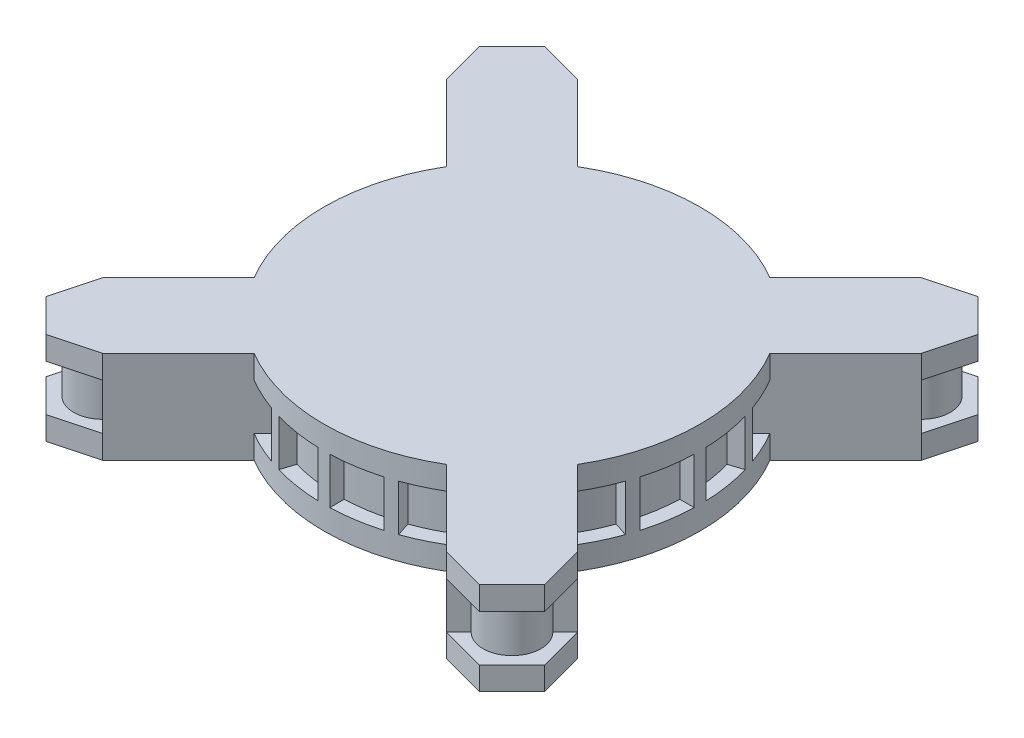
from build123d import *

# Parameters (mm, degrees)
BOSS_EXTRUDE8_DEPTH  = 4
BOSS_EXTRUDE10_DEPTH = 8
BOSS_EXTRUDE11_DEPTH = 4


with BuildPart() as part:
    # Sketch11 → Boss-Extrude8 (new body)
    with BuildSketch(Plane(origin=(0, 0, 0), x_dir=(1, 0, 0), z_dir=(0, 1, 0))):
        with BuildLine():
            Line((27.930717857, -16.617009358), (41.012193309, -29.69848481))
            Line((41.012193309, -29.69848481), (43.08274567, -37.42589142))
            Line((43.08274567, -37.42589142), (37.42589142, -43.08274567))
            Line((37.42589142, -43.08274567), (29.69848481, -41.012193309))
            Line((29.69848481, -41.012193309), (16.617009358, -27.930717857))
            ThreePointArc((16.617009358, -27.930717857), (0, -32.5), (-16.617009358, -27.930717857))
            Line((-16.617009358, -27.930717857), (-29.69848481, -41.012193309))
            Line((-29.69848481, -41.012193309), (-37.42589142, -43.08274567))
            Line((-37.42589142, -43.08274567), (-43.08274567, -37.42589142))
            Line((-43.08274567, -37.42589142), (-41.012193309, -29.69848481))
            Line((-41.012193309, -29.69848481), (-27.930717857, -16.617009358))
            ThreePointArc((-27.930717857, -16.617009358), (-32.5, 0), (-27.930717857, 16.617009358))
            Line((-27.930717857, 16.617009358), (-41.012193309, 29.69848481))
            Line((-41.012193309, 29.69848481), (-43.08274567, 37.42589142))
            Line((-43.08274567, 37.42589142), (-37.42589142, 43.08274567))
            Line((-37.42589142, 43.08274567), (-29.69848481, 41.012193309))
            Line((-29.69848481, 41.012193309), (-16.617009358, 27.930717857))
            ThreePointArc((-16.617009358, 27.930717857), (0, 32.5), (16.617009358, 27.930717857))
            Line((16.617009358, 27.930717857), (29.69848481, 41.012193309))
            Line((29.69848481, 41.012193309), (37.42589142, 43.08274567))
            Line((37.42589142, 43.08274567), (43.08274567, 37.42589142))
            Line((43.08274567, 37.42589142), (41.012193309, 29.69848481))
            Line((41.012193309, 29.69848481), (27.930717857, 16.617009358))
            ThreePointArc((27.930717857, 16.617009358), (32.5, 0), (27.930717857, -16.617009358))
        make_face()
    extrude(amount=BOSS_EXTRUDE8_DEPTH)

    # Sketch12 → Boss-Extrude10 (add)
    with BuildSketch(Plane(origin=(0, 4, 0), x_dir=(1, 0, 0), z_dir=(0, 1, 0))):
        with BuildLine():
            Line((38.890872967, 31.819805152), (41.012193309, 29.69848481))
            Line((41.012193309, 29.69848481), (26.10190255, 14.788194051))
            ThreePointArc((26.10190255, 14.788194051), (27.250407583, 12.546524879), (28.206823147, 10.216414633))
            Line((28.206823147, 10.216414633), (30.585684682, 10.9893536))
            ThreePointArc((30.585684682, 10.9893536), (30.90933678, 10.043052317), (31.203718671, 9.087240568))
            Line((31.203718671, 9.087240568), (28.824857136, 8.3143016))
            ThreePointArc((28.824857136, 8.3143016), (29.630650218, 4.693033951), (29.983328701, 1))
            Line((29.983328701, 1), (32.484611742, 1))
            ThreePointArc((32.484611742, 1), (32.5, 0), (32.484611742, -1))
            Line((32.484611742, -1), (29.983328701, -1))
            ThreePointArc((29.983328701, -1), (29.630650218, -4.693033951), (28.824857136, -8.3143016))
            Line((28.824857136, -8.3143016), (31.203718671, -9.087240568))
            ThreePointArc((31.203718671, -9.087240568), (30.90933678, -10.043052317), (30.585684682, -10.9893536))
            Line((30.585684682, -10.9893536), (28.206823147, -10.216414633))
            ThreePointArc((28.206823147, -10.216414633), (27.250407583, -12.546524879), (26.10190255, -14.788194051))
            Line((26.10190255, -14.788194051), (41.012193309, -29.69848481))
            Line((41.012193309, -29.69848481), (38.890872965, -31.819805153))
            ThreePointArc((38.890872965, -31.819805153), (38.890872965, -38.890872967), (31.819805152, -38.890872967))
            Line((31.819805152, -38.890872967), (29.69848481, -41.012193309))
            Line((29.69848481, -41.012193309), (14.788194051, -26.10190255))
            ThreePointArc((14.788194051, -26.10190255), (12.546524879, -27.250407583), (10.216414633, -28.206823147))
            Line((10.216414633, -28.206823147), (10.9893536, -30.585684682))
            ThreePointArc((10.9893536, -30.585684682), (10.043052317, -30.90933678), (9.087240568, -31.203718671))
            Line((9.087240568, -31.203718671), (8.3143016, -28.824857136))
            ThreePointArc((8.3143016, -28.824857136), (4.693033951, -29.630650218), (1, -29.983328701))
            Line((1, -29.983328701), (1, -32.484611742))
            ThreePointArc((1, -32.484611742), (0, -32.5), (-1, -32.484611742))
            Line((-1, -32.484611742), (-1, -29.983328701))
            ThreePointArc((-1, -29.983328701), (-4.693033951, -29.630650218), (-8.3143016, -28.824857136))
            Line((-8.3143016, -28.824857136), (-9.087240568, -31.203718671))
            ThreePointArc((-9.087240568, -31.203718671), (-10.043052317, -30.90933678), (-10.9893536, -30.585684682))
            Line((-10.9893536, -30.585684682), (-10.216414633, -28.206823147))
            ThreePointArc((-10.216414633, -28.206823147), (-12.546524879, -27.250407583), (-14.788194051, -26.10190255))
            Line((-14.788194051, -26.10190255), (-29.69848481, -41.012193309))
            Line((-29.69848481, -41.012193309), (-31.819805153, -38.890872965))
            ThreePointArc((-31.819805153, -38.890872965), (-38.890872967, -38.890872965), (-38.890872967, -31.819805152))
            Line((-38.890872967, -31.819805152), (-41.012193309, -29.69848481))
            Line((-41.012193309, -29.69848481), (-26.10190255, -14.788194051))
            ThreePointArc((-26.10190255, -14.788194051), (-27.250407583, -12.546524879), (-28.206823147, -10.216414633))
            Line((-28.206823147, -10.216414633), (-30.585684682, -10.9893536))
            ThreePointArc((-30.585684682, -10.9893536), (-30.90933678, -10.043052317), (-31.203718671, -9.087240568))
            Line((-31.203718671, -9.087240568), (-28.824857136, -8.3143016))
            ThreePointArc((-28.824857136, -8.3143016), (-29.630650218, -4.693033951), (-29.983328701, -1))
            Line((-29.983328701, -1), (-32.484611742, -1))
            ThreePointArc((-32.484611742, -1), (-32.5, 0), (-32.484611742, 1))
            Line((-32.484611742, 1), (-29.983328701, 1))
            ThreePointArc((-29.983328701, 1), (-29.630650218, 4.693033951), (-28.824857136, 8.3143016))
            Line((-28.824857136, 8.3143016), (-31.203718671, 9.087240568))
            ThreePointArc((-31.203718671, 9.087240568), (-30.90933678, 10.043052317), (-30.585684682, 10.9893536))
            Line((-30.585684682, 10.9893536), (-28.206823147, 10.216414633))
            ThreePointArc((-28.206823147, 10.216414633), (-27.250407583, 12.546524879), (-26.10190255, 14.788194051))
            Line((-26.10190255, 14.788194051), (-41.012193309, 29.69848481))
            Line((-41.012193309, 29.69848481), (-38.890872965, 31.819805153))
            ThreePointArc((-38.890872965, 31.819805153), (-38.890872965, 38.890872967), (-31.819805152, 38.890872967))
            Line((-31.819805152, 38.890872967), (-29.69848481, 41.012193309))
            Line((-29.69848481, 41.012193309), (-14.788194051, 26.10190255))
            ThreePointArc((-14.788194051, 26.10190255), (-12.546524879, 27.250407583), (-10.216414633, 28.206823147))
            Line((-10.216414633, 28.206823147), (-10.9893536, 30.585684682))
            ThreePointArc((-10.9893536, 30.585684682), (-10.043052317, 30.90933678), (-9.087240568, 31.203718671))
            Line((-9.087240568, 31.203718671), (-8.3143016, 28.824857136))
            ThreePointArc((-8.3143016, 28.824857136), (-4.693033951, 29.630650218), (-1, 29.983328701))
            Line((-1, 29.983328701), (-1, 32.484611742))
            ThreePointArc((-1, 32.484611742), (0, 32.5), (1, 32.484611742))
            Line((1, 32.484611742), (1, 29.983328701))
            ThreePointArc((1, 29.983328701), (4.693033951, 29.630650218), (8.3143016, 28.824857136))
            Line((8.3143016, 28.824857136), (9.087240568, 31.203718671))
            ThreePointArc((9.087240568, 31.203718671), (10.043052317, 30.90933678), (10.9893536, 30.585684682))
            Line((10.9893536, 30.585684682), (10.216414633, 28.206823147))
            ThreePointArc((10.216414633, 28.206823147), (12.546524879, 27.250407583), (14.788194051, 26.10190255))
            Line((14.788194051, 26.10190255), (29.69848481, 41.012193309))
            Line((29.69848481, 41.012193309), (31.819805153, 38.890872965))
            ThreePointArc((31.819805153, 38.890872965), (38.890872967, 38.890872965), (38.890872967, 31.819805152))
        make_face()
    extrude(amount=BOSS_EXTRUDE10_DEPTH)

    # Sketch13 → Boss-Extrude11 (add)
    with BuildSketch(Plane(origin=(0, 12, 0), x_dir=(1, 0, 0), z_dir=(0, 1, 0))):
        with BuildLine():
            Line((27.930717857, -16.617009358), (41.012193309, -29.69848481))
            Line((41.012193309, -29.69848481), (43.08274567, -37.42589142))
            Line((43.08274567, -37.42589142), (37.42589142, -43.08274567))
            Line((37.42589142, -43.08274567), (29.69848481, -41.012193309))
            Line((29.69848481, -41.012193309), (16.617009358, -27.930717857))
            ThreePointArc((16.617009358, -27.930717857), (0, -32.5), (-16.617009358, -27.930717857))
            Line((-16.617009358, -27.930717857), (-29.69848481, -41.012193309))
            Line((-29.69848481, -41.012193309), (-37.42589142, -43.08274567))
            Line((-37.42589142, -43.08274567), (-43.08274567, -37.42589142))
            Line((-43.08274567, -37.42589142), (-41.012193309, -29.69848481))
            Line((-41.012193309, -29.69848481), (-27.930717857, -16.617009358))
            ThreePointArc((-27.930717857, -16.617009358), (-32.5, 0), (-27.930717857, 16.617009358))
            Line((-27.930717857, 16.617009358), (-41.012193309, 29.69848481))
            Line((-41.012193309, 29.69848481), (-43.08274567, 37.42589142))
            Line((-43.08274567, 37.42589142), (-37.42589142, 43.08274567))
            Line((-37.42589142, 43.08274567), (-29.69848481, 41.012193309))
            Line((-29.69848481, 41.012193309), (-16.617009358, 27.930717857))
            ThreePointArc((-16.617009358, 27.930717857), (0, 32.5), (16.617009358, 27.930717857))
            Line((16.617009358, 27.930717857), (29.69848481, 41.012193309))
            Line((29.69848481, 41.012193309), (37.42589142, 43.08274567))
            Line((37.42589142, 43.08274567), (43.08274567, 37.42589142))
            Line((43.08274567, 37.42589142), (41.012193309, 29.69848481))
            Line((41.012193309, 29.69848481), (27.930717857, 16.617009358))
            ThreePointArc((27.930717857, 16.617009358), (32.5, 0), (27.930717857, -16.617009358))
        make_face()
    extrude(amount=BOSS_EXTRUDE11_DEPTH)


solid = part.part
